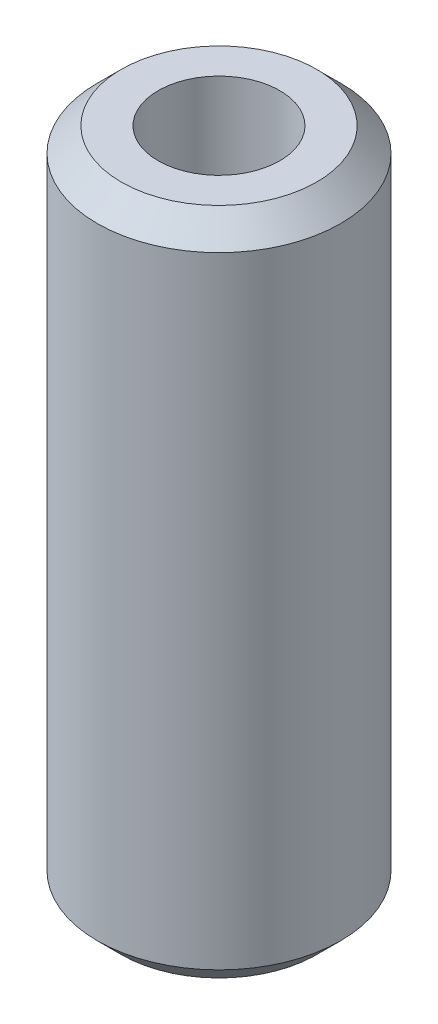
from build123d import *

# Parameters (mm, degrees)
SKETCH1_R           = 12.7
SKETCH1_R_2         = 6.35
BOSS_EXTRUDE1_DEPTH = 34.925
CHAMFER2_SIZE       = 2.5


with BuildPart() as part:
    # Sketch1 → Boss-Extrude1 (new, symmetric)
    with BuildSketch(Plane(origin=(0, 0, 0), x_dir=(1, 0, 0), z_dir=(0, 1, 0))):
        with Locations(Location((0, 0, 0), (0, 0, 270))):
            Circle(SKETCH1_R)
        with Locations(Location((0, 0, 0), (0, 0, 270))):
            Circle(SKETCH1_R_2, mode=Mode.SUBTRACT)
    extrude(amount=BOSS_EXTRUDE1_DEPTH, both=True)

    # Chamfer2
    chamfer2_edges = [part.edges().sort_by_distance(p)[0] for p in [
        (0, -34.925, -12.7),
        (0, 34.925, -12.7),
    ]]
    chamfer(chamfer2_edges, length=CHAMFER2_SIZE)


solid = part.part
